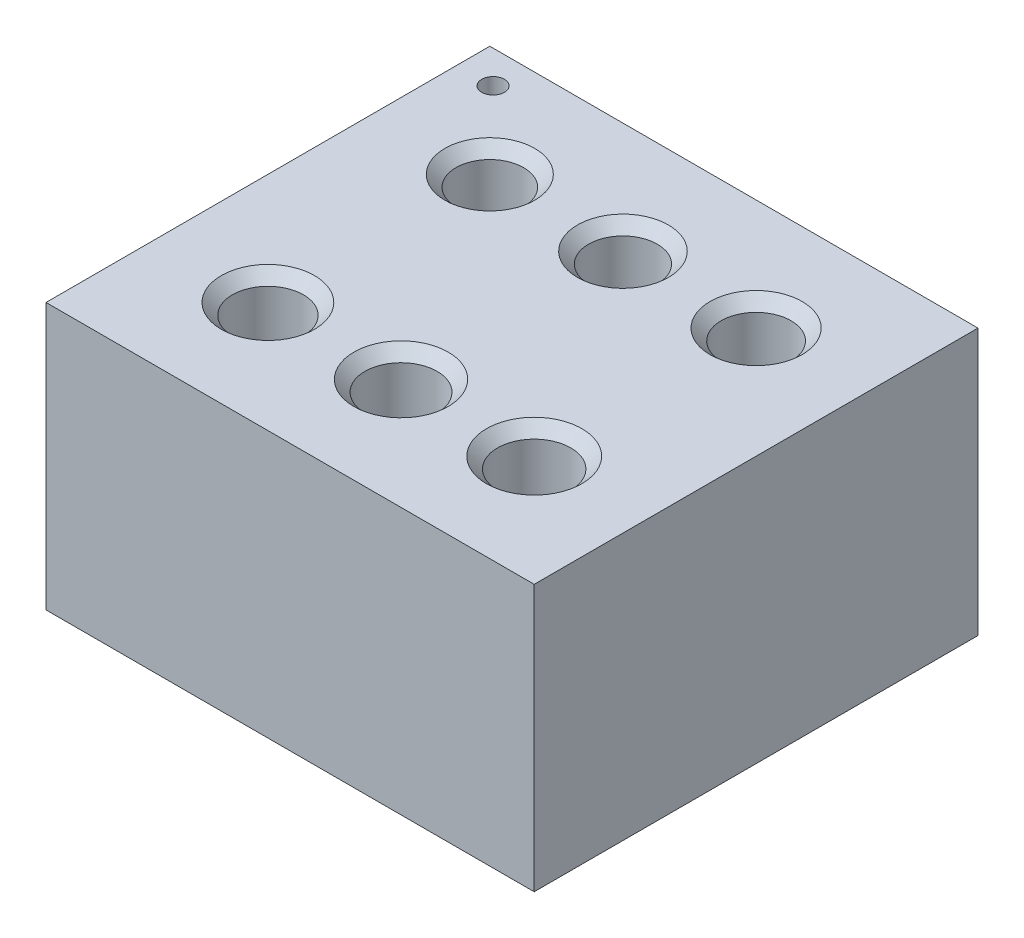
from build123d import *

# Parameters (mm, degrees)
SKETCH1_W           = 22
SKETCH1_H           = 20
SKETCH1_R           = 0.511248757
BOSS_EXTRUDE1_DEPTH = 12
SKETCH1_3_R         = 1.525
SKETCH1_3_R_2       = 1.55
SKETCH1_3_R_3       = 1.575
SKETCH1_3_R_4       = 1.6
SKETCH1_3_R_5       = 1.625
SKETCH1_3_R_6       = 1.65
CUT_EXTRUDE1_DEPTH  = 20.104973175
CHAMFER1_SIZE       = 0.5


with BuildPart() as part:
    # Sketch1 → Boss-Extrude1 (new body)
    with BuildSketch(Plane(origin=(0, 0, 0), x_dir=(1, 0, 0), z_dir=(0, 1, 0))):
        Rectangle(SKETCH1_W, SKETCH1_H)
        with Locations((-9.381564608, 8.528695098)):
            Circle(SKETCH1_R, mode=Mode.SUBTRACT)
    extrude(amount=-BOSS_EXTRUDE1_DEPTH)

    # Sketch1<3> → Cut-Extrude1 (cut, through all)
    with BuildSketch(Plane(origin=(0, 0, 0), x_dir=(1, 0, 0), z_dir=(0, 1, 0))):
        with Locations((-6, 5)):
            Circle(SKETCH1_3_R)
        with Locations((0, 5)):
            Circle(SKETCH1_3_R_2)
        with Locations((6, 5)):
            Circle(SKETCH1_3_R_3)
        with Locations((-6, -5)):
            Circle(SKETCH1_3_R_4)
        with Locations((0, -5)):
            Circle(SKETCH1_3_R_5)
        with Locations((6, -5)):
            Circle(SKETCH1_3_R_6)
    extrude(amount=-CUT_EXTRUDE1_DEPTH, mode=Mode.SUBTRACT)

    # Chamfer1
    chamfer1_edges = [part.edges().sort_by_distance(p)[0] for p in [
        (-7.6, 0, 5),
        (-1.625, 0, 5),
        (4.35, 0, 5),
        (4.425, 0, -5),
        (-1.55, 0, -5),
        (-7.525, 0, -5),
    ]]
    chamfer(chamfer1_edges, length=CHAMFER1_SIZE)


solid = part.part
